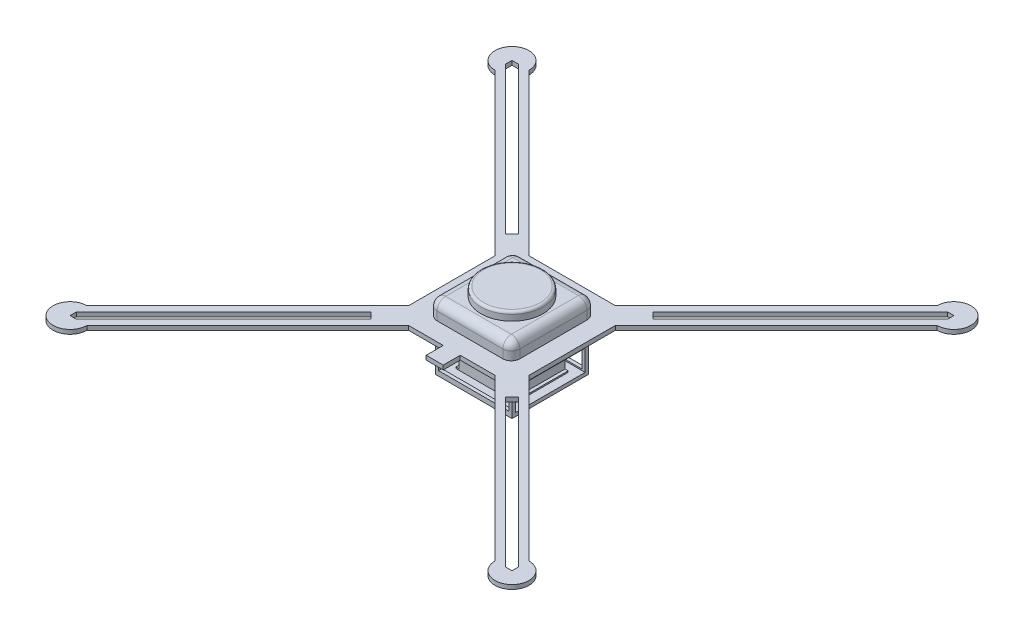
from build123d import *

# Parameters (mm, degrees)
EXTRUDE_1_DEPTH     = 5
SKETCH_2_W          = 90
SKETCH_2_H          = 90
EXTRUDE_2_DEPTH     = 25
SKETCH_3_W          = 82.667839838
SKETCH_3_H          = 15.058257345
CUT_EXTRUDE_1_DEPTH = 90
SKETCH_4_W          = 82.085695662
SKETCH_4_H          = 16.995101666
CUT_EXTRUDE_2_DEPTH = 90
SKETCH_5_W          = 97.364780094
SKETCH_5_H          = 98.94366842
EXTRUDE_3_DEPTH     = 20
FILLET_1_R          = 10
SKETCH_6_W          = 90
SKETCH_6_H          = 90
EXTRUDE_4_DEPTH     = 30
CUT_EXTRUDE_3_DEPTH = 90
SKETCH_8_W          = 62.667839838
SKETCH_8_H          = 13.124346315
CUT_EXTRUDE_4_DEPTH = 10
CUT_EXTRUDE_5_DEPTH = 90
SKETCH_10_W         = 62.085695662
SKETCH_10_H         = 21.626220655
CUT_EXTRUDE_6_DEPTH = 10
SKETCH_11_W         = 62.667839838
SKETCH_11_H         = 13.124346315
CUT_EXTRUDE_7_DEPTH = 10
SKETCH_12_W         = 62.085695662
SKETCH_12_H         = 21.626220655
CUT_EXTRUDE_8_DEPTH = 10
EXTRUDE_5_DEPTH     = 20
SKETCH_14_R         = 36.481947273
EXTRUDE_6_DEPTH     = 10
FILLET_2_R          = 3


with BuildPart() as part:
    # 草图1 → 凸台-拉伸1 (new body)
    with BuildSketch(Plane(origin=(0, 0, 0), x_dir=(1, 0, 0), z_dir=(0, 1, 0))):
        Polygon((0, 70.903454713), (0, 0), (70.90345471, 0), (70.90345471, 50.896669322), (70.90345471, 63.546624398), (70.90345471, 70.903454713), (63.546624395, 70.903454713), (50.896669319, 70.903454713), align=None)
        Polygon((72.962659229, 92.969444623), (50.896669319, 70.903454713), (63.546624395, 70.903454713), (79.287636767, 86.644467085), align=None)
        Polygon((70.90345471, 70.903454713), (70.90345471, 63.546624398), (86.644467082, 79.28763677), (79.287636767, 86.644467085), (63.546624395, 70.903454713), align=None)
        Polygon((70.90345471, 63.546624398), (70.90345471, 50.896669322), (92.96944462, 72.962659232), (86.644467082, 79.28763677), align=None)
        with BuildLine():
            ThreePointArc((242.661241038, 250.018071355), (240.67172678, 254.833829646), (239.993214606, 260))
            Line((239.993214606, 260), (72.962659229, 92.969444623))
            Line((72.962659229, 92.969444623), (79.287636767, 86.644467085))
            Line((79.287636767, 86.644467085), (242.661241038, 250.018071355))
        make_face()
        with BuildLine():
            Line((92.96944462, 72.962659232), (260, 239.993214612))
            ThreePointArc((260, 239.993214606), (254.833829644, 240.67172678), (250.018071352, 242.66124104))
            Line((250.018071352, 242.66124104), (86.644467082, 79.28763677))
            Line((86.644467082, 79.28763677), (92.96944462, 72.962659232))
        make_face()
        with BuildLine():
            Line((260, 252.643169688), (260, 239.993214612))
            ThreePointArc((260, 239.993214606), (274.146933622, 245.853066378), (280.006785394, 260))
            ThreePointArc((280.006785394, 260), (260, 280.006785394), (239.993214606, 260))
            Line((239.993214606, 260), (252.643169682, 260))
            Line((252.643169682, 260), (260, 260))
            Line((260, 260), (260, 252.643169688))
        make_face()
        with BuildLine():
            Line((252.643169682, 260), (239.993214606, 260))
            ThreePointArc((239.993214606, 260), (240.67172678, 254.833829646), (242.661241038, 250.018071355))
            Line((242.661241038, 250.018071355), (252.643169682, 260))
        make_face()
        with BuildLine():
            ThreePointArc((250.018071352, 242.66124104), (254.833829644, 240.67172678), (260, 239.993214606))
            Line((260, 239.993214612), (260, 252.643169688))
            Line((260, 252.643169688), (250.018071352, 242.66124104))
        make_face()
    extrude_1 = extrude(amount=EXTRUDE_1_DEPTH)

    # 镜向1: 凸台-拉伸1 across plane
    add(extrude_1.mirror(Plane(origin=(0, 5, 0), x_dir=(0, 0, 1), z_dir=(1, 0, 0))))

    # 镜向3: part across plane


with BuildPart() as part_1:
    add(part.part)
    add(part.part.mirror(Plane(origin=(0, 5, 0), x_dir=(1, 0, 0), z_dir=(0, 0, -1))))

    # 草图2 → 凸台-拉伸2 (add)
    with BuildSketch(Plane.XZ):
        Rectangle(SKETCH_2_W, SKETCH_2_H)
    extrude(amount=EXTRUDE_2_DEPTH)

    # 草图3 → 切除-拉伸1 (cut)
    with BuildSketch(Plane.XY.offset(45)):
        with Locations((0, -12.246888496)):
            Rectangle(SKETCH_3_W, SKETCH_3_H)
    extrude(amount=-CUT_EXTRUDE_1_DEPTH, mode=Mode.SUBTRACT)

    # 草图4 → 切除-拉伸2 (cut)
    with BuildSketch(Plane(origin=(45, 0, 0), x_dir=(0, 0, -1), z_dir=(1, 0, 0))):
        with Locations((0, -12.272398252)):
            Rectangle(SKETCH_4_W, SKETCH_4_H)
    extrude(amount=-CUT_EXTRUDE_2_DEPTH, mode=Mode.SUBTRACT)

    # 草图5 → 凸台-拉伸3 (add)
    with BuildSketch(Plane(origin=(0, 5, 0), x_dir=(1, 0, 0), z_dir=(0, 1, 0))):
        Rectangle(SKETCH_5_W, SKETCH_5_H)
    extrude(amount=EXTRUDE_3_DEPTH)

    # 圆角1
    fillet_1_edges = [part_1.edges().sort_by_distance(p)[0] for p in [
        (48.682390047, 15, 49.47183421),
        (48.682390047, 15, -49.47183421),
        (-48.682390047, 15, -49.47183421),
        (-48.682390047, 15, 49.47183421),
        (48.682390047, 25, 0),
        (0, 25, -49.47183421),
        (-48.682390047, 25, 0),
        (0, 25, 49.47183421),
    ]]
    fillet(fillet_1_edges, radius=FILLET_1_R)

    # 草图6 → 凸台-拉伸4 (add)
    with BuildSketch(Plane.XZ.offset(25)):
        Rectangle(SKETCH_6_W, SKETCH_6_H)
    extrude(amount=EXTRUDE_4_DEPTH)

    # 草图7 → 切除-拉伸3 (cut)
    with BuildSketch(Plane.XY.offset(45)):
        Polygon((-41.333919919, -25.414932676), (41.333919919, -25.414932676), (41.333919919, -49.347564191), (31.333919919, -49.347564191), (31.333919919, -36.223217876), (-31.333919919, -36.223217876), (-31.333919919, -49.347564191), (-41.333919919, -49.347564191), align=None)
    extrude(amount=-CUT_EXTRUDE_3_DEPTH, mode=Mode.SUBTRACT)

    # 草图8 → 切除-拉伸4 (cut)
    with BuildSketch(Plane.XY.offset(45)):
        with Locations((0, -42.785391034)):
            Rectangle(SKETCH_8_W, SKETCH_8_H)
    extrude(amount=-CUT_EXTRUDE_4_DEPTH, mode=Mode.SUBTRACT)

    # 草图9 → 切除-拉伸5 (cut)
    with BuildSketch(Plane(origin=(45, 0, 0), x_dir=(0, 0, -1), z_dir=(1, 0, 0))):
        Polygon((-41.042847831, -26.273596919), (-41.042847831, -50.943507888), (-31.042847831, -50.943507888), (-31.042847831, -29.317287233), (31.042847831, -29.317287233), (31.042847831, -50.943507888), (41.042847831, -50.943507888), (41.042847831, -26.273596919), align=None)
    extrude(amount=-CUT_EXTRUDE_5_DEPTH, mode=Mode.SUBTRACT)

    # 草图10 → 切除-拉伸6 (cut)
    with BuildSketch(Plane(origin=(45, 0, 0), x_dir=(0, 0, -1), z_dir=(1, 0, 0))):
        with Locations((0, -40.130397561)):
            Rectangle(SKETCH_10_W, SKETCH_10_H)
    extrude(amount=-CUT_EXTRUDE_6_DEPTH, mode=Mode.SUBTRACT)

    # 草图11 → 切除-拉伸7 (cut)
    with BuildSketch(Plane(origin=(0, 0, -45), x_dir=(-1, 0, 0), z_dir=(0, 0, -1))):
        with Locations((0, -42.785391034)):
            Rectangle(SKETCH_11_W, SKETCH_11_H)
    extrude(amount=-CUT_EXTRUDE_7_DEPTH, mode=Mode.SUBTRACT)

    # 草图12 → 切除-拉伸8 (cut)
    with BuildSketch(Plane.ZY.offset(45)):
        with Locations((0, -40.130397561)):
            Rectangle(SKETCH_12_W, SKETCH_12_H)
    extrude(amount=-CUT_EXTRUDE_8_DEPTH, mode=Mode.SUBTRACT)

    # 草图13 → 凸台-拉伸5 (add)
    with BuildSketch(Plane.XY.offset(70.903454713)):
        Polygon((0, 0), (-10, 0), (-10, 5), (10, 5), (10, 0), align=None)
    extrude(amount=EXTRUDE_5_DEPTH)

    # 草图14 → 凸台-拉伸6 (add)
    with BuildSketch(Plane(origin=(0, 25, 0), x_dir=(1, 0, 0), z_dir=(0, 1, 0))):
        with Locations(Location((0, 0, 0), (0, 0, 270))):
            Circle(SKETCH_14_R)
    extrude(amount=EXTRUDE_6_DEPTH)

    # 圆角2
    fillet_2_edges = [part_1.edges().sort_by_distance(p)[0] for p in [
        (0, 35, -36.481947273),
    ]]
    fillet(fillet_2_edges, radius=FILLET_2_R)


solid = part_1.part
